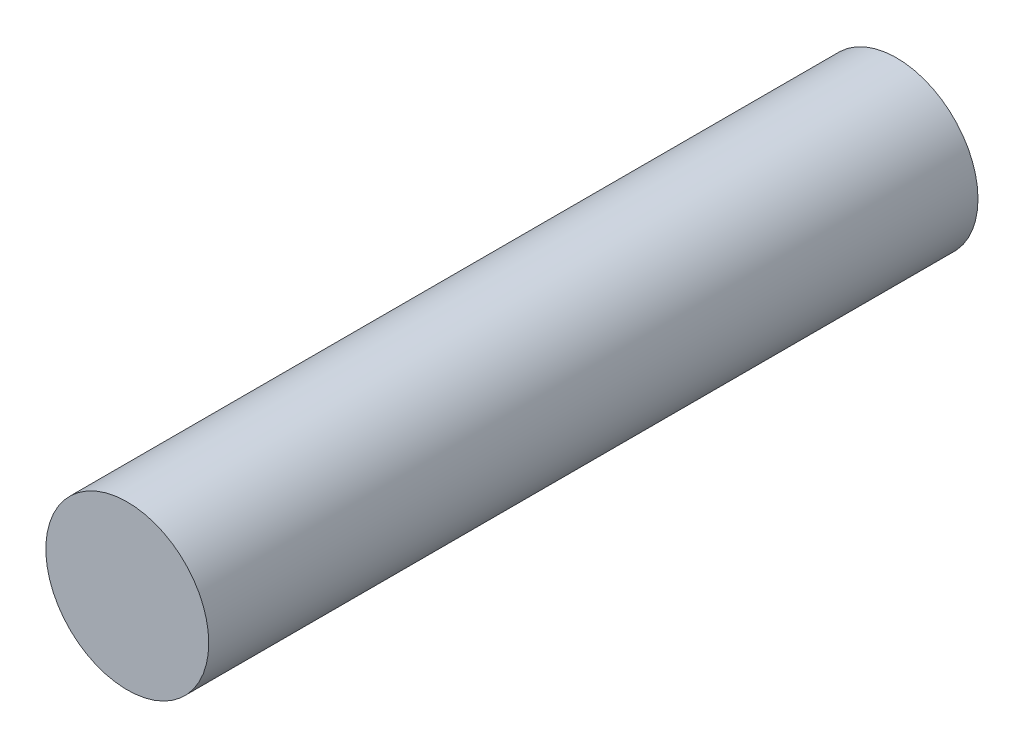
from build123d import *

# Parameters (mm, degrees)
SKETCH1_R           = 1.8
BOSS_EXTRUDE1_DEPTH = 17


with BuildPart() as part:
    # Sketch1 → Boss-Extrude1 (new body)
    with BuildSketch(Plane.XY):
        Circle(SKETCH1_R)
    extrude(amount=BOSS_EXTRUDE1_DEPTH)


solid = part.part
